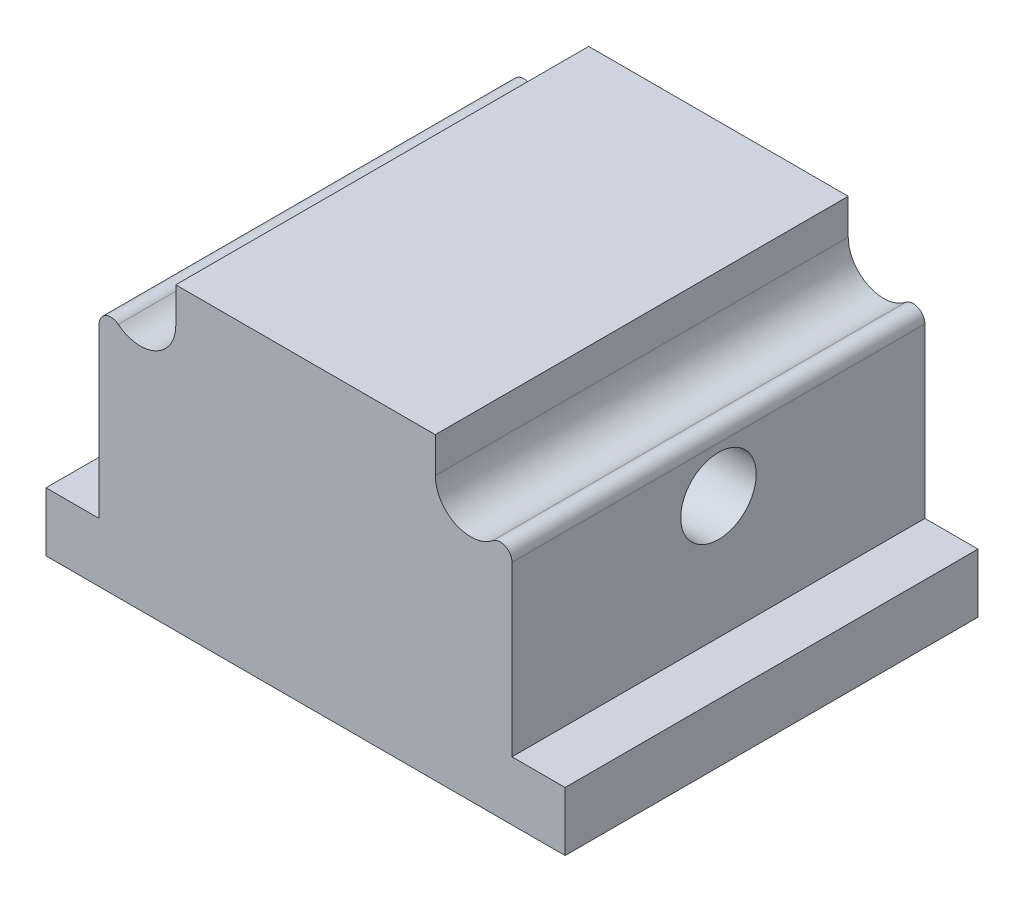
from build123d import *

# Parameters (mm, degrees)
SKETCH_1_W          = 17.5
SKETCH_1_H          = 17.5
EXTRUDE_1_DEPTH     = 5
SKETCH_3_R          = 1.6
CUT_EXTRUDE_1_DEPTH = 21.194368027
CUT_EXTRUDE_2_DEPTH = 21.194368027
SKETCH_6_W          = 17.5
SKETCH_6_H          = 17.5
EXTRUDE_2_DEPTH     = 0.2
SKETCH_7_W          = 22
SKETCH_7_H          = 17.5
EXTRUDE_3_DEPTH     = 2.5
CUT_EXTRUDE_3_DEPTH = 1.5


with BuildPart() as part:
    # 草图1 → 凸台-拉伸1 (new, symmetric)
    with BuildSketch(Plane(origin=(0, 0, 0), x_dir=(1, 0, 0), z_dir=(0, 1, 0))):
        Rectangle(SKETCH_1_W, SKETCH_1_H)
    extrude(amount=EXTRUDE_1_DEPTH, both=True)

    # 草图3 → 切除-拉伸1 (cut, through all)
    with BuildSketch(Plane(origin=(8.75, 0, 0), x_dir=(0, 0, -1), z_dir=(1, 0, 0))):
        Circle(SKETCH_3_R)
    extrude(amount=-CUT_EXTRUDE_1_DEPTH, mode=Mode.SUBTRACT)

    # 草图4 → 切除-拉伸2 (cut, through all)
    with BuildSketch(Plane(origin=(0, 0, -8.75), x_dir=(-1, 0, 0), z_dir=(0, 0, -1))):
        with BuildLine():
            Line((5.5, 3.5), (5.5, 5))
            Line((5.5, 5), (8.5, 5))
            Line((8.5, 5), (8.75, 5))
            Line((8.75, 5), (8.75, 1.9387505))
            ThreePointArc((8.75, 1.9387505), (8.466506351, 2.38944441), (7.9375, 2.329062875))
            ThreePointArc((7.9375, 2.329062875), (6.350480947, 2.147918272), (5.5, 3.5))
        make_face()
        with BuildLine():
            Line((-5.5, 5), (-8.5, 5))
            Line((-8.5, 5), (-8.75, 5))
            Line((-8.75, 5), (-8.75, 1.9387505))
            ThreePointArc((-8.75, 1.9387505), (-8.466506351, 2.38944441), (-7.9375, 2.329062875))
            ThreePointArc((-7.9375, 2.329062875), (-6.350480947, 2.147918272), (-5.5, 3.5))
            Line((-5.5, 3.5), (-5.5, 5))
        make_face()
    extrude(amount=-CUT_EXTRUDE_2_DEPTH, mode=Mode.SUBTRACT)

    # 草图6 → 凸台-拉伸2 (add)
    with BuildSketch(Plane.XZ.offset(5)):
        Rectangle(SKETCH_6_W, SKETCH_6_H)
    extrude(amount=EXTRUDE_2_DEPTH)

    # 草图7 → 凸台-拉伸3 (add)
    with BuildSketch(Plane.XZ.offset(5.2)):
        Rectangle(SKETCH_7_W, SKETCH_7_H)
    extrude(amount=EXTRUDE_3_DEPTH)

    # 草图8 → 切除-拉伸3 (cut)
    with BuildSketch(Plane.XZ.offset(7.7)):
        Polygon((-8, 0), (-2.472135955, -1.796111906), (-2.472135955, -7.60845213), (0.94427191, -2.906170112), (6.472135955, -4.702282018), (3.05572809, 0), (6.472135955, 4.702282018), (0.94427191, 2.906170112), (-2.472135955, 7.60845213), (-2.472135955, 1.796111906), align=None)
    extrude(amount=-CUT_EXTRUDE_3_DEPTH, mode=Mode.SUBTRACT)


solid = part.part
